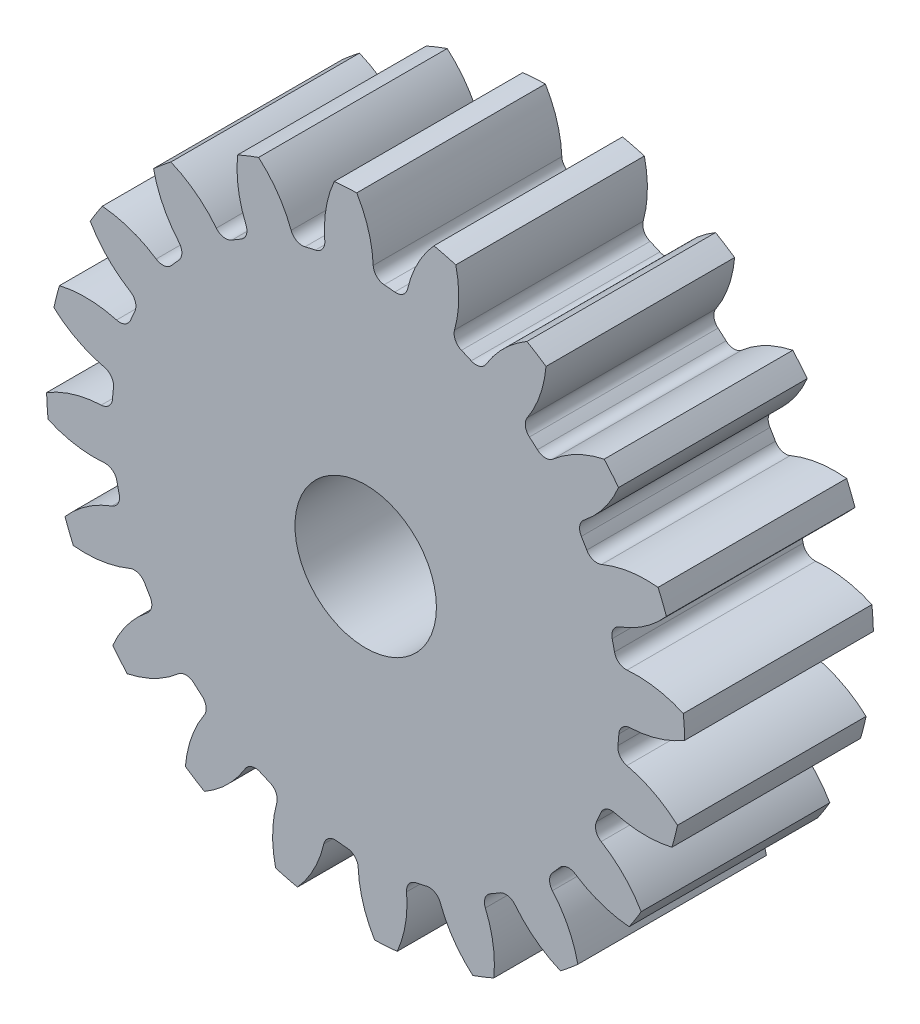
from build123d import *

# Parameters (mm, degrees)
SKETCH3_R         = 10.746153846
GEARBODY_DEPTH    = 6.35
TOOTHCUT_DEPTH    = 17.470644947
CIRPATTERN1_COUNT = 20
BOREDIA_R         = 2.38125
BORE_DEPTH        = 12700


with BuildPart() as part:
    # Sketch3 → gearBody (new body)
    with BuildSketch(Plane.XY):
        Circle(SKETCH3_R)
    extrude(amount=GEARBODY_DEPTH)

    # Sketch2 → toothCut (cut, through all)
    with BuildSketch(Plane.XY):
        with BuildLine():
            ThreePointArc((8.490041281, -0.977455211), (8.508658478, -0.79934383), (8.523539515, -0.620881456))
            ThreePointArc((8.523539515, -0.620881456), (8.642948408, -0.365014625), (8.902319681, -0.253422235))
            ThreePointArc((8.902319681, -0.253422235), (10.621287798, 0.231275883), (11.940487157, 1.435226341))
            ThreePointArc((11.940487157, 1.435226341), (11.973712099, -1.124867441), (11.464261837, -3.633979735))
            ThreePointArc((11.464261837, -3.633979735), (10.39237495, -2.205399267), (8.793756274, -1.409031273))
            ThreePointArc((8.793756274, -1.409031273), (8.559706783, -1.25108459), (8.490041281, -0.977455211))
        make_face()
    toothcut = extrude(amount=TOOTHCUT_DEPTH, mode=Mode.SUBTRACT)

    # CirPattern1: toothCut ×20 about axis
    cirpattern1_axis = Axis((0, 0, 6.35), (0, 0, -1))
    for i in range(1, CIRPATTERN1_COUNT):
        add(toothcut.rotate(cirpattern1_axis, i * 360 / CIRPATTERN1_COUNT), mode=Mode.SUBTRACT)

    # boreDia → bore (cut, symmetric)
    with BuildSketch(Plane.XY):
        Circle(BOREDIA_R)
    extrude(amount=BORE_DEPTH, both=True, mode=Mode.SUBTRACT)


solid = part.part
